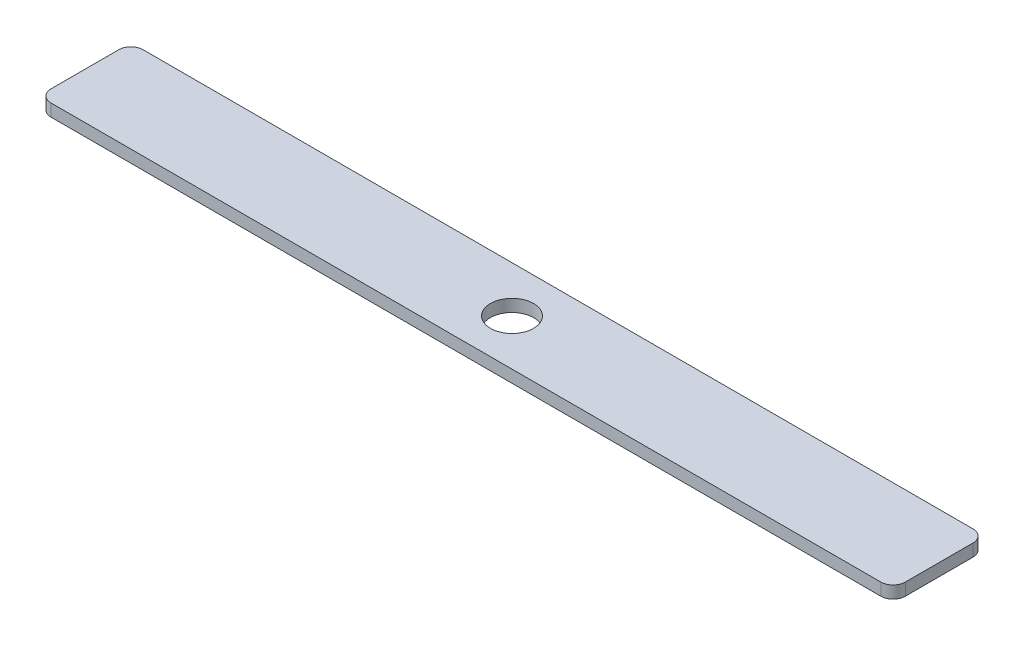
from build123d import *

# Parameters (mm, degrees)
SKETCH1_W           = 353.187
SKETCH1_H           = 38.1
SKETCH1_R           = 8.911624301
BOSS_EXTRUDE1_DEPTH = 5.08
FILLET1_R           = 5.08


with BuildPart() as part:
    # Sketch1 → Boss-Extrude1 (new body)
    with BuildSketch(Plane(origin=(0, 0, 0), x_dir=(1, 0, 0), z_dir=(0, 1, 0))):
        Rectangle(SKETCH1_W, SKETCH1_H)
        with Locations(Location((0, 0, 0), (0, 0, 270))):
            Circle(SKETCH1_R, mode=Mode.SUBTRACT)
    extrude(amount=-BOSS_EXTRUDE1_DEPTH)

    # Fillet1
    fillet1_edges = [part.edges().sort_by_distance(p)[0] for p in [
        (-176.5935, -2.54, -19.05),
        (176.5935, -2.54, -19.05),
        (176.5935, -2.54, 19.05),
        (-176.5935, -2.54, 19.05),
    ]]
    fillet(fillet1_edges, radius=FILLET1_R)


solid = part.part
